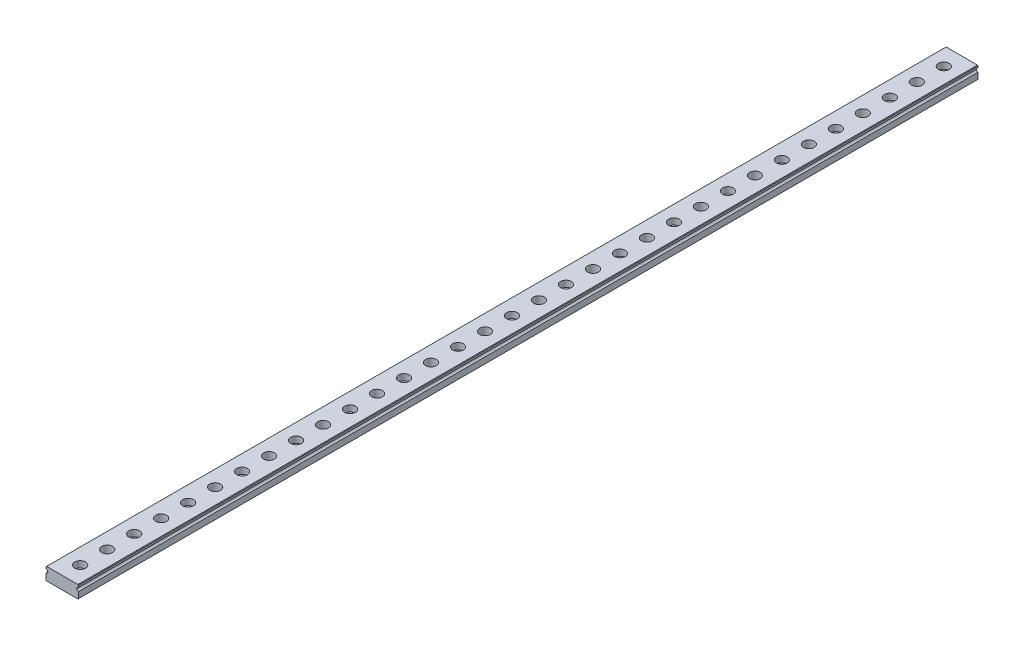
from build123d import *

# Parameters (mm, degrees)
ESBO_O1_W                                            = 18
ESBO_O1_H                                            = 500
RESSALTO_EXTRUS_O1_DEPTH                             = 7
FURO_DE_DI_METRO_2_0_2_1_D                           = 2
FURO_DE_DI_METRO_6_0_6_1_D                           = 6
REBAIXO_PARA_PARAFUSO_DE_M_QUINA_DE_CABE_D           = 3.5
REBAIXO_PARA_PARAFUSO_DE_M_QUINA_DE_CABE_CBORE_D     = 6
REBAIXO_PARA_PARAFUSO_DE_M_QUINA_DE_CABE_CBORE_DEPTH = 3.5
PADR_O_LINEAR1_COUNT                                 = 16
PADR_O_LINEAR1_PITCH                                 = 30
PADR_O_LINEAR2_COUNT                                 = 17
PADR_O_LINEAR2_PITCH                                 = 30
CHANFRO1_SIZE                                        = 0.3


with BuildPart() as part:
    # Esboço1 → Ressalto-extrusão1 (new body)
    with BuildSketch(Plane.XZ):
        with Locations((-9, -250)):
            Rectangle(ESBO_O1_W, ESBO_O1_H)
    extrude(amount=-RESSALTO_EXTRUS_O1_DEPTH)

    # Furo de diâmetro Ø2.0 (2)1 (through all)
    with Locations(Plane(origin=(0, 0, -500), x_dir=(-1, 0, 0), z_dir=(0, 0, -1))):
        with Locations((0, 4.7), (18, 4.7)):
            Hole(FURO_DE_DI_METRO_2_0_2_1_D / 2)

    # Furo de diâmetro Ø6.0 (6)1 (through all)
    with Locations(Plane(origin=(0, 7, 0), x_dir=(1, 0, 0), z_dir=(0, 1, 0))):
        with Locations((-9, 25)):
            furo_de_di_metro_6_0_6_1 = Hole(FURO_DE_DI_METRO_6_0_6_1_D / 2)

    # Rebaixo para parafuso de máquina de cabeça sextavada de M31 (through all)
    with Locations(Plane(origin=(0, 7, 0), x_dir=(1, 0, 0), z_dir=(0, 1, 0))):
        with Locations((-9, 10)):
            rebaixo_para_parafuso_de_m_quina_de_cabe = CounterBoreHole(REBAIXO_PARA_PARAFUSO_DE_M_QUINA_DE_CABE_D / 2, REBAIXO_PARA_PARAFUSO_DE_M_QUINA_DE_CABE_CBORE_D / 2, REBAIXO_PARA_PARAFUSO_DE_M_QUINA_DE_CABE_CBORE_DEPTH)

    # Padrão linear1: Furo de diâmetro Ø6.0 (6)1 ×16
    with Locations(*[(0, 0, -i * PADR_O_LINEAR1_PITCH) for i in range(1, PADR_O_LINEAR1_COUNT)]):
        add(furo_de_di_metro_6_0_6_1, mode=Mode.SUBTRACT)

    # Padrão linear2: Rebaixo para parafuso de máquina de cabeça sextavada de M31 ×17
    with Locations(*[(0, 0, -i * PADR_O_LINEAR2_PITCH) for i in range(1, PADR_O_LINEAR2_COUNT)]):
        add(rebaixo_para_parafuso_de_m_quina_de_cabe, mode=Mode.SUBTRACT)

    # Chanfro1
    chanfro1_edges = [part.edges().sort_by_distance(p)[0] for p in [
        (0, 7, -250),
        (-18, 7, -250),
        (0, 0, -250),
        (-18, 0, -250),
    ]]
    chamfer(chanfro1_edges, length=CHANFRO1_SIZE)


solid = part.part
